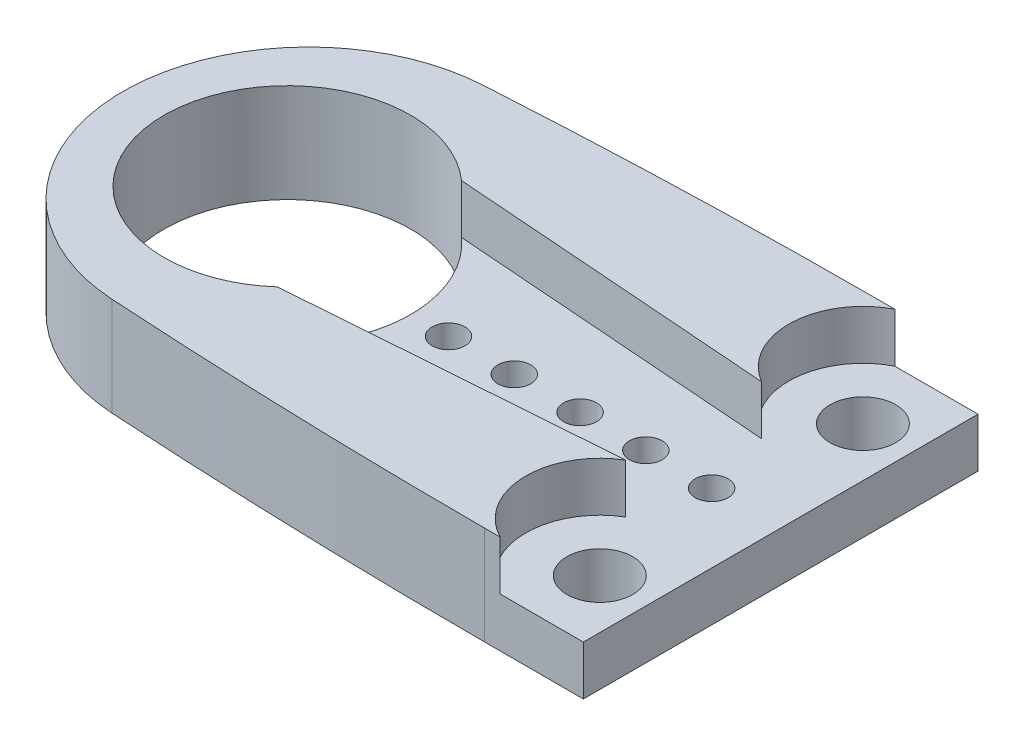
from build123d import *

# Parameters (mm, degrees)
SKETCH1_R               = 1
SKETCH1_R_2             = 2.35
BOSS_EXTRUDE1_DEPTH     = 3
ENL_V_MAT_EXTRU_1_DEPTH = 1.5
ESQUISSE3_R             = 0.5
ESQUISSE3_R_2           = 3.75
ENL_V_MAT_EXTRU_7_DEPTH = 17.224980878
ENL_V_MAT_EXTRU_8_DEPTH = 1.5


with BuildPart() as part:
    # Sketch1 → Boss-Extrude1 (new body)
    with BuildSketch(Plane(origin=(0, 0, 0), x_dir=(1, 0, 0), z_dir=(0, 1, 0))):
        with BuildLine():
            Line((15, 6), (12, 6))
            ThreePointArc((12, 6), (6.147204023, 5.909534011), (0.3, 5.638222479))
            ThreePointArc((0.3, 5.638222479), (-5, 0), (0.3, -5.638222479))
            ThreePointArc((0.3, -5.638222479), (6.147204023, -5.909534011), (12, -6))
            Line((12, -6), (15, -6))
            Line((15, -6), (15, 6))
        make_face()
        with Locations(Location((13.5, -4, 0), (0, 0, 270))):
            Circle(SKETCH1_R, mode=Mode.SUBTRACT)
        with Locations(Location((13.5, 4, 0), (0, 0, 270))):
            Circle(SKETCH1_R, mode=Mode.SUBTRACT)
        with Locations(Location((0, 0, 0), (0, 0, 270))):
            Circle(SKETCH1_R_2, mode=Mode.SUBTRACT)
    extrude(amount=-BOSS_EXTRUDE1_DEPTH)

    # Esquisse1 → Enlèv. mat.-Extru.1 (cut)
    with BuildSketch(Plane(origin=(0, 0, 0), x_dir=(1, 0, 0), z_dir=(0, 1, 0))):
        with BuildLine():
            Line((2.494493937, -2.8), (14.131406802, -1.932309126))
            add(Edge.make_bspline(
                [(14.131406802, -1.932309126), (14.497286128, -1.904835216), (14.827491954, -1.746052706), (15.157338026, -1.587443187), (15.407154881, -1.318584734), (15.656200737, -1.050556048), (15.790562016, -0.709168668), (15.92490372, -0.367831024), (15.925, 0), (15.925095847, 0.366175279), (15.791018176, 0.708007672), (15.657374187, 1.048734388), (15.407835717, 1.317851242), (15.159067388, 1.586137532), (14.828615817, 1.74551148), (14.498449498, 1.904747853), (14.131406802, 1.932309126)],
                knots=[0, 0, 0, 0.125, 0.125, 0.25, 0.25, 0.375, 0.375, 0.5, 0.5, 0.625, 0.625, 0.75, 0.75, 0.875, 0.875, 1, 1, 1], degree=2))
            Line((14.131406802, 1.932309126), (2.494493937, 2.8))
            ThreePointArc((2.494493937, 2.8), (-3.75, 0), (2.494493937, -2.8))
        make_face()
    extrude(amount=-ENL_V_MAT_EXTRU_1_DEPTH, mode=Mode.SUBTRACT)

    # Esquisse3 → Enlèv. mat.-Extru.7 (cut, through all)
    with BuildSketch(Plane(origin=(0, -1.5, 0), x_dir=(1, 0, 0), z_dir=(0, 1, 0))):
        with Locations(Location((4.9, 0, 0), (0, 0, 270))):
            Circle(ESQUISSE3_R)
        with Locations(Location((6.9, 0, 0), (0, 0, 270))):
            Circle(ESQUISSE3_R)
        with Locations(Location((8.9, 0, 0), (0, 0, 270))):
            Circle(ESQUISSE3_R)
        with Locations(Location((10.9, 0, 0), (0, 0, 270))):
            Circle(ESQUISSE3_R)
        with Locations(Location((12.9, 0, 0), (0, 0, 270))):
            Circle(ESQUISSE3_R)
        with Locations(Location((0, 0, 0), (0, 0, 270))):
            Circle(ESQUISSE3_R_2)
    extrude(amount=-ENL_V_MAT_EXTRU_7_DEPTH, mode=Mode.SUBTRACT)

    # Esquisse4 → Enlèv. mat.-Extru.8 (cut)
    with BuildSketch(Plane(origin=(0, 0, 0), x_dir=(1, 0, 0), z_dir=(0, 1, 0))):
        with BuildLine():
            Line((13.5, -1.75), (13.5, 1.75))
            ThreePointArc((13.5, 1.75), (11.25, 4), (13.5, 6.25))
            Line((13.5, 6.25), (13.5, 7.352249371))
            Line((13.5, 7.352249371), (16.575189436, 7.352249371))
            Line((16.575189436, 7.352249371), (16.575189436, -9.01785128))
            Line((16.575189436, -9.01785128), (13.5, -9.01785128))
            Line((13.5, -9.01785128), (13.5, -6.25))
            ThreePointArc((13.5, -6.25), (11.25, -4), (13.5, -1.75))
        make_face()
    extrude(amount=-ENL_V_MAT_EXTRU_8_DEPTH, mode=Mode.SUBTRACT)


solid = part.part
